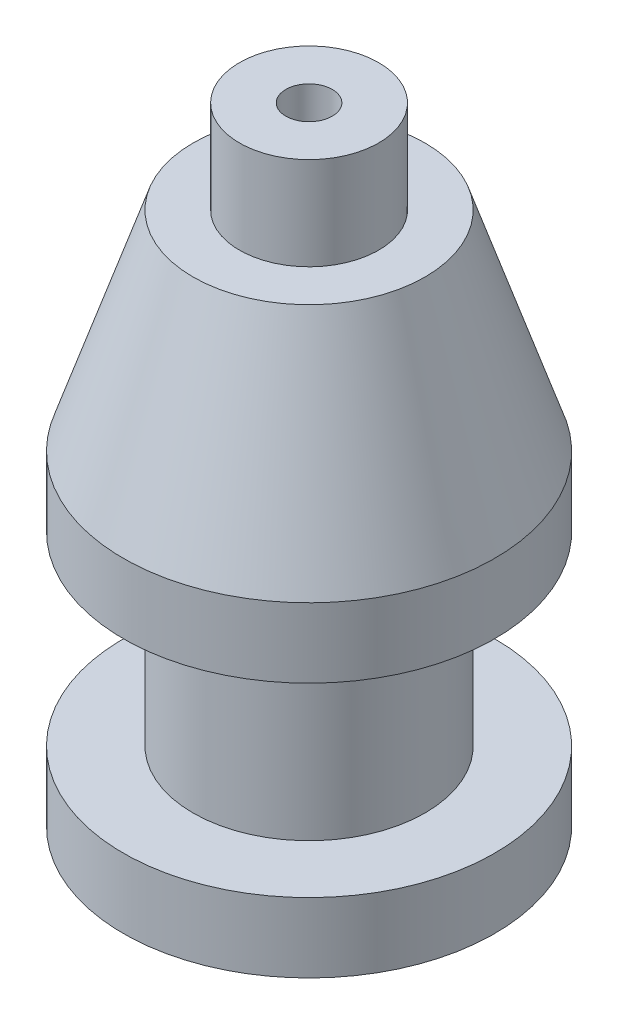
from build123d import *


with BuildPart() as part:
    # Sketch1 → Revolve1 (revolve)
    with BuildSketch(Plane.XY, mode=Mode.PRIVATE) as revolve1_sk:
        Polygon((10, 0), (10, 270), (30, 270), (30, 230), (50, 230), (80, 140), (80, 110), (50, 110), (50, 30), (80, 30), (80, 0), align=None)
    revolve(revolve1_sk.sketch.rotate(Axis((0, 0, 0), (0, 1, 0)), 90), axis=Axis((0, 0, 0), (0, 1, 0)))


solid = part.part
